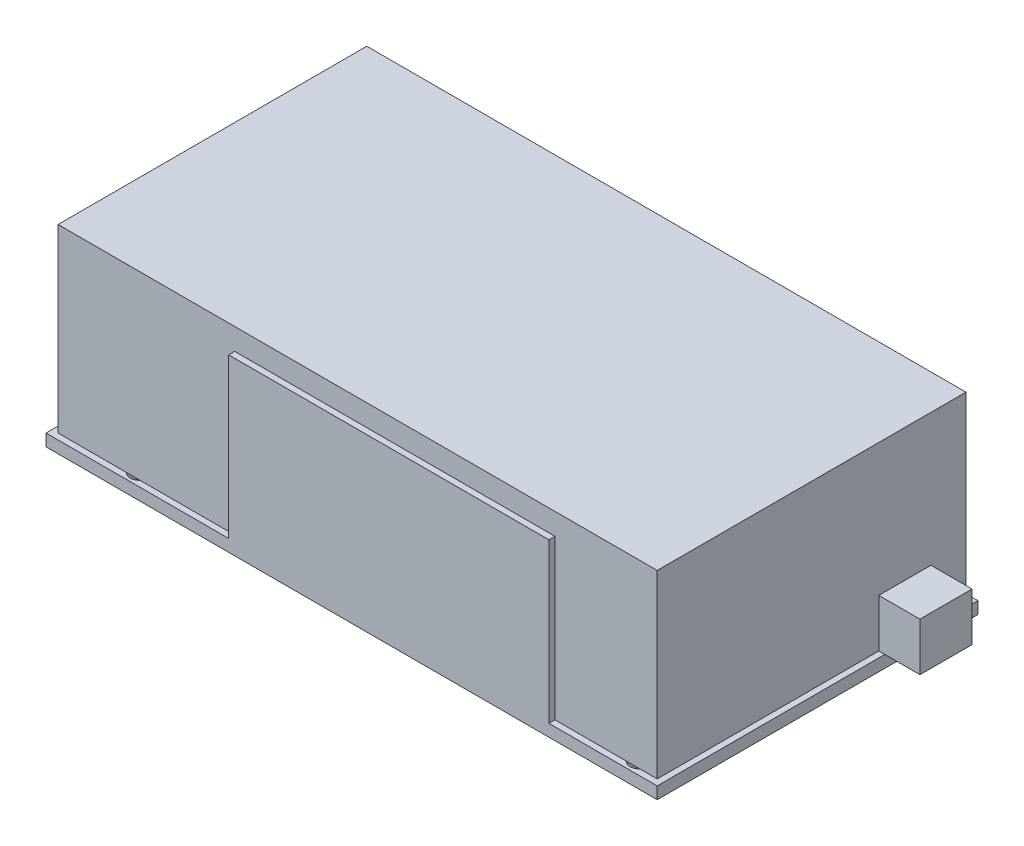
from build123d import *

# Parameters (mm, degrees)
ESBO_O1_W                  = 101.55
ESBO_O1_H                  = 53.3
RESSALTO_EXTRUS_O1_DEPTH   = 2
ESBO_O2_W                  = 53.2
ESBO_O2_H                  = 53.3
RESSALTO_EXTRUS_O2_DEPTH   = 26.416687688
CORTE_EXTRUS_O2_DEPTH      = 64.136079332
CORTE_EXTRUS_O2_DEPTH_BACK = 64.64
ESBO_O5_R                  = 1.5
ESBO_O6_W                  = 99.55
ESBO_O6_H                  = 51.3
RESSALTO_EXTRUS_O4_DEPTH   = 30
ESBO_O7_W                  = 16.925657076
ESBO_O7_H                  = 8.663776605
RESSALTO_EXTRUS_O5_DEPTH   = 8


with BuildPart() as part:
    # Esboço1 → Ressalto-extrusão1 (new body)
    with BuildSketch(Plane(origin=(0, 0, 0), x_dir=(1, 0, 0), z_dir=(0, 1, 0))):
        Rectangle(ESBO_O1_W, ESBO_O1_H)
    extrude(amount=RESSALTO_EXTRUS_O1_DEPTH)

    # Esboço2 → Ressalto-extrusão2 (add)
    with BuildSketch(Plane(origin=(0, 2, 0), x_dir=(1, 0, 0), z_dir=(0, 1, 0))):
        with Locations((6.175, 0)):
            Rectangle(ESBO_O2_W, ESBO_O2_H)
    extrude(amount=RESSALTO_EXTRUS_O2_DEPTH)

    # Esboço5 → Corte-extrusão2 (cut, two sides: drawn at the far end of the back side and taken through both)
    with BuildSketch(Plane(origin=(0, 2, 0), x_dir=(1, 0, 0), z_dir=(0, 1, 0)).offset(-CORTE_EXTRUS_O2_DEPTH_BACK)):
        with Locations(Location((-37.275, -24.65, 0), (0, 0, 90))):
            Circle(ESBO_O5_R)
        with Locations(Location((45.775, -24.65, 0), (0, 0, 90))):
            Circle(ESBO_O5_R)
        with Locations(Location((-36.275, 24.65, 0), (0, 0, 90))):
            Circle(ESBO_O5_R)
        with Locations(Location((39.275, 24.65, 0), (0, 0, 90))):
            Circle(ESBO_O5_R)
    extrude(amount=CORTE_EXTRUS_O2_DEPTH + CORTE_EXTRUS_O2_DEPTH_BACK, mode=Mode.SUBTRACT)

    # Esboço6 → Ressalto-extrusão4 (add)
    with BuildSketch(Plane(origin=(0, 2, 0), x_dir=(1, 0, 0), z_dir=(0, 1, 0))):
        Rectangle(ESBO_O6_W, ESBO_O6_H)
    extrude(amount=RESSALTO_EXTRUS_O4_DEPTH)

    # Esboço7 → Ressalto-extrusão5 (add)
    with BuildSketch(Plane(origin=(0, 2, 0), x_dir=(1, 0, 0), z_dir=(0, 1, 0))):
        with Locations((48.14371548, 15.499389289)):
            Rectangle(ESBO_O7_W, ESBO_O7_H)
    extrude(amount=RESSALTO_EXTRUS_O5_DEPTH)


solid = part.part
